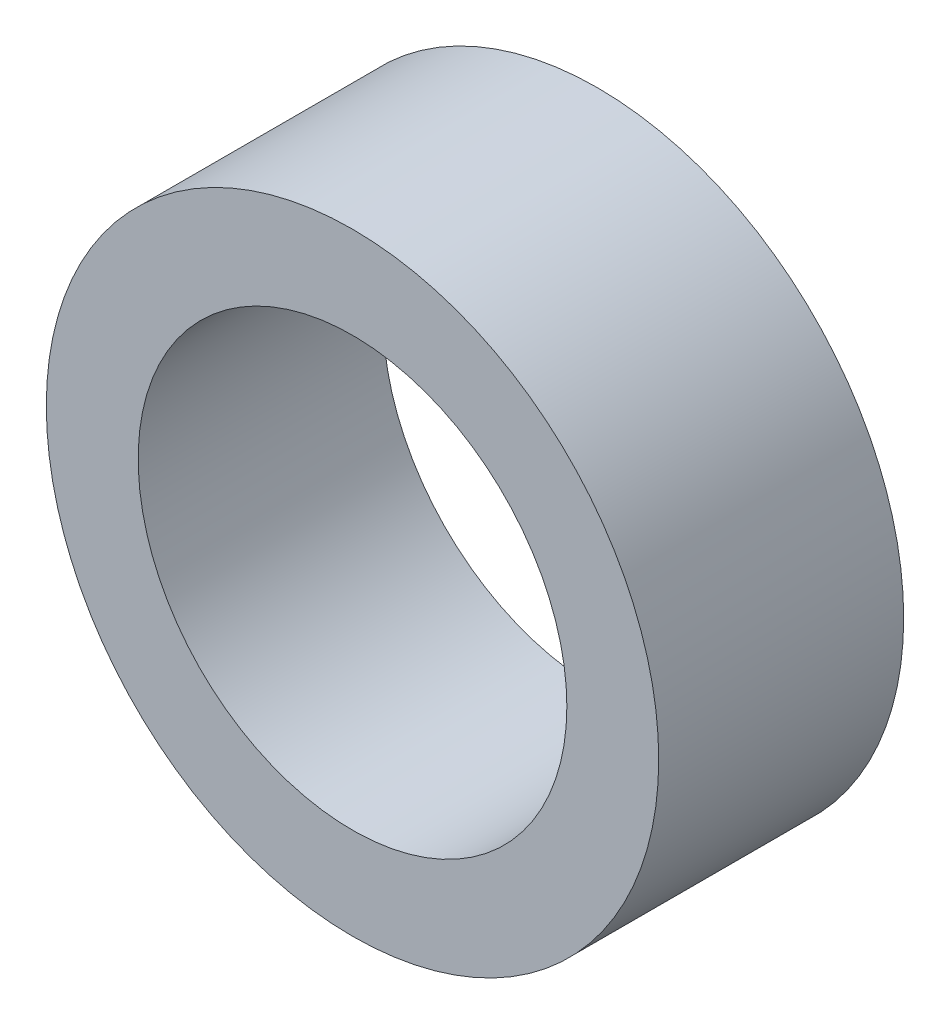
from build123d import *

# Parameters (mm, degrees)
SKETCH1_R           = 25
SKETCH1_R_2         = 17.5
BOSS_EXTRUDE1_DEPTH = 20


with BuildPart() as part:
    # Sketch1 → Boss-Extrude1 (new body)
    with BuildSketch(Plane.XY):
        Circle(SKETCH1_R)
        Circle(SKETCH1_R_2, mode=Mode.SUBTRACT)
    extrude(amount=BOSS_EXTRUDE1_DEPTH)


solid = part.part
